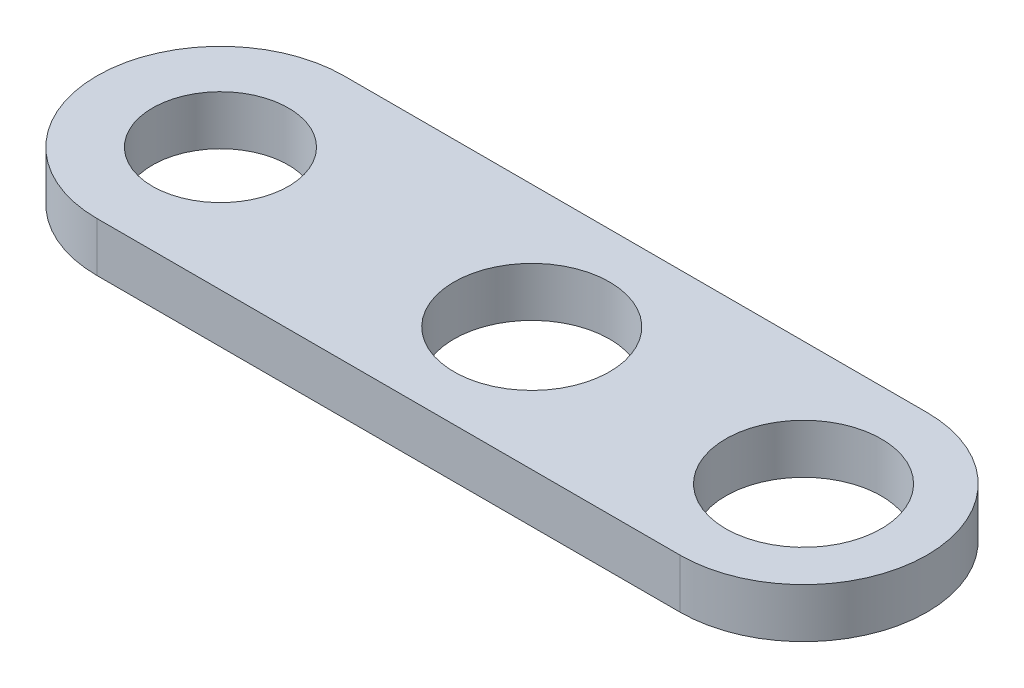
from build123d import *

# Parameters (mm, degrees)
SKETCH2_R           = 3.15
SKETCH2_R_2         = 2.75
BOSS_EXTRUDE1_DEPTH = 2


with BuildPart() as part:
    # Sketch2 → Boss-Extrude1 (new body)
    with BuildSketch(Plane(origin=(0, 0, 0), x_dir=(1, 0, 0), z_dir=(0, 1, 0))):
        with BuildLine():
            Line((23.6, 5), (0, 5))
            ThreePointArc((0, 5), (-5, 0), (0, -5))
            Line((0, -5), (23.6, -5))
            ThreePointArc((23.6, -5), (28.6, 0), (23.6, 5))
        make_face()
        with Locations(Location((23.6, 0, 0), (0, 0, 270))):
            Circle(SKETCH2_R, mode=Mode.SUBTRACT)
        with Locations(Location((12.6, 0, 0), (0, 0, 90))):
            Circle(SKETCH2_R, mode=Mode.SUBTRACT)
        with Locations(Location((0, 0, 0), (0, 0, 270))):
            Circle(SKETCH2_R_2, mode=Mode.SUBTRACT)
    extrude(amount=-BOSS_EXTRUDE1_DEPTH)


solid = part.part
